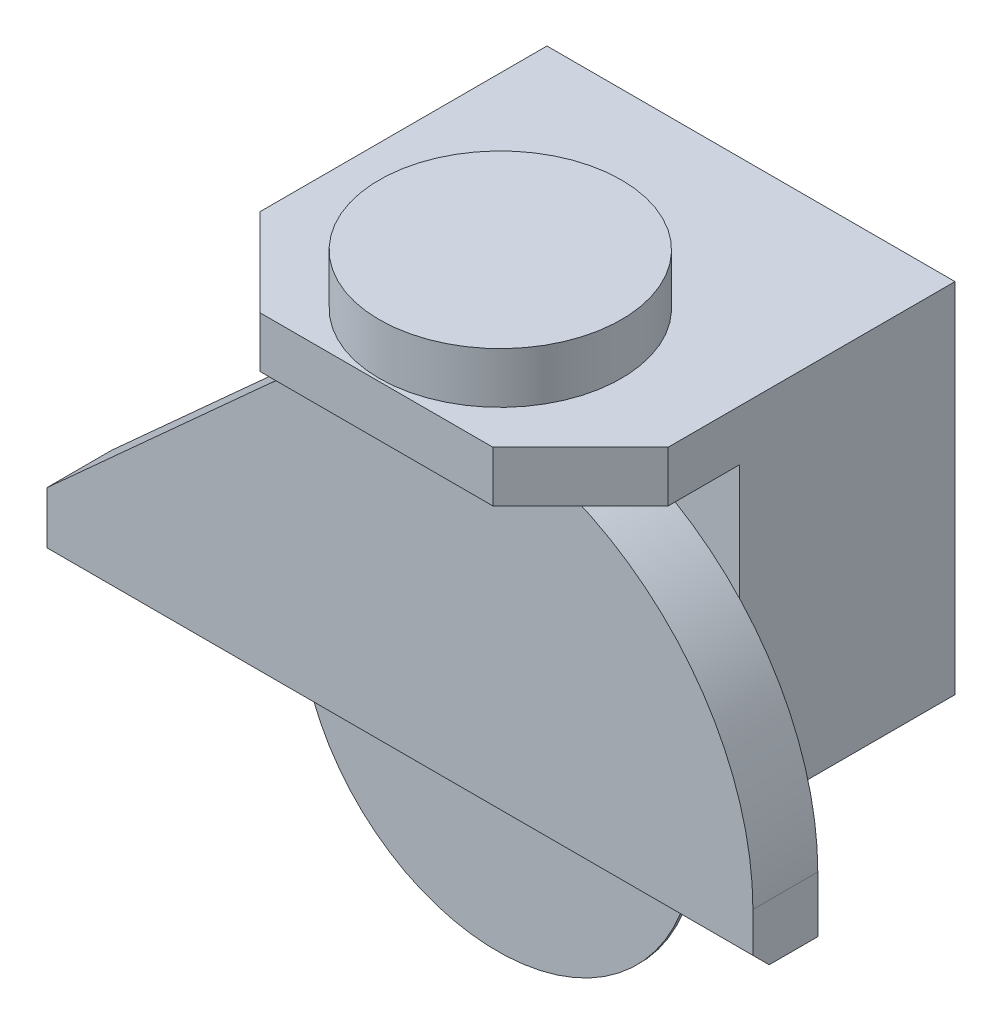
from build123d import *

# Parameters (mm, degrees)
SKETCH1_R                = 225
BOSS_EXTRUDE1_DEPTH      = 3.5
SKETCH2_R                = 105.863842181
BOSS_EXTRUDE2_DEPTH      = 350
SKETCH3_W                = 465.371554394
SKETCH3_H                = 246.036459022
BOSS_EXTRUDE3_DEPTH      = 350
BOSS_EXTRUDE4_DEPTH      = 38
BOSS_EXTRUDE4_DEPTH_BACK = 36
CUT_EXTRUDE1_DEPTH       = 1011
BOSS_EXTRUDE5_DEPTH      = 58
SKETCH7_R                = 138.083103167
BOSS_EXTRUDE6_DEPTH      = 58


with BuildPart() as part:
    # Sketch1 → Boss-Extrude1 (new body)
    with BuildSketch(Plane.XY):
        Circle(SKETCH1_R)
    extrude(amount=BOSS_EXTRUDE1_DEPTH)

    # Sketch2 → Boss-Extrude2 (add)
    with BuildSketch(Plane(origin=(0, 0, 0), x_dir=(-1, 0, 0), z_dir=(0, 0, -1))):
        Circle(SKETCH2_R)
    extrude(amount=BOSS_EXTRUDE2_DEPTH)

    # Sketch3 → Boss-Extrude3 (add)
    with BuildSketch(Plane(origin=(0, 0, 0), x_dir=(1, 0, 0), z_dir=(0, 1, 0))):
        with Locations((0, 162.855088027)):
            Rectangle(SKETCH3_W, SKETCH3_H)
    extrude(amount=BOSS_EXTRUDE3_DEPTH)

    # Sketch4 → Boss-Extrude4 (add, two sides: drawn at the far end of the back side and taken through both)
    with BuildSketch(Plane.XY.offset(3.5).offset(-BOSS_EXTRUDE4_DEPTH_BACK)):
        with BuildLine():
            Line((-475.524623773, -63.931124179), (329.566599898, -63.931124179))
            Line((329.566599898, -63.931124179), (329.566599898, 0))
            ThreePointArc((329.566599898, 0), (133.661871779, 301.245162287), (-221.148477595, 244.351170707))
            Line((-221.148477595, 244.351170707), (-475.524623773, 14.129652631))
            Line((-475.524623773, 14.129652631), (-475.524623773, -63.931124179))
        make_face()
    extrude(amount=BOSS_EXTRUDE4_DEPTH + BOSS_EXTRUDE4_DEPTH_BACK)

    # Sketch5 → Cut-Extrude1 (cut)
    with BuildSketch(Plane(origin=(329.566599898, 0, 0), x_dir=(0, 0, -1), z_dir=(1, 0, 0))):
        Polygon((-41.5, -63.931124179), (-41.5, -45.396753324), (-22.965629146, -63.931124179), align=None)
    extrude(amount=-CUT_EXTRUDE1_DEPTH, mode=Mode.SUBTRACT)

    # Sketch6 → Boss-Extrude5 (add)
    with BuildSketch(Plane(origin=(0, 350, 0), x_dir=(1, 0, 0), z_dir=(0, 1, 0))):
        Polygon((-232.685777197, 285.873317538), (232.685777197, 285.873317538), (232.685777197, -41.230401705), (132.685777197, -141.230401705), (-132.685777197, -141.230401705), (-232.685777197, -41.230401705), align=None)
    extrude(amount=BOSS_EXTRUDE5_DEPTH)

    # Sketch7 → Boss-Extrude6 (add)
    with BuildSketch(Plane(origin=(0, 408, 0), x_dir=(1, 0, 0), z_dir=(0, 1, 0))):
        with Locations(Location((0, 0, 0), (0, 0, 270))):
            Circle(SKETCH7_R)
    extrude(amount=BOSS_EXTRUDE6_DEPTH)


solid = part.part
